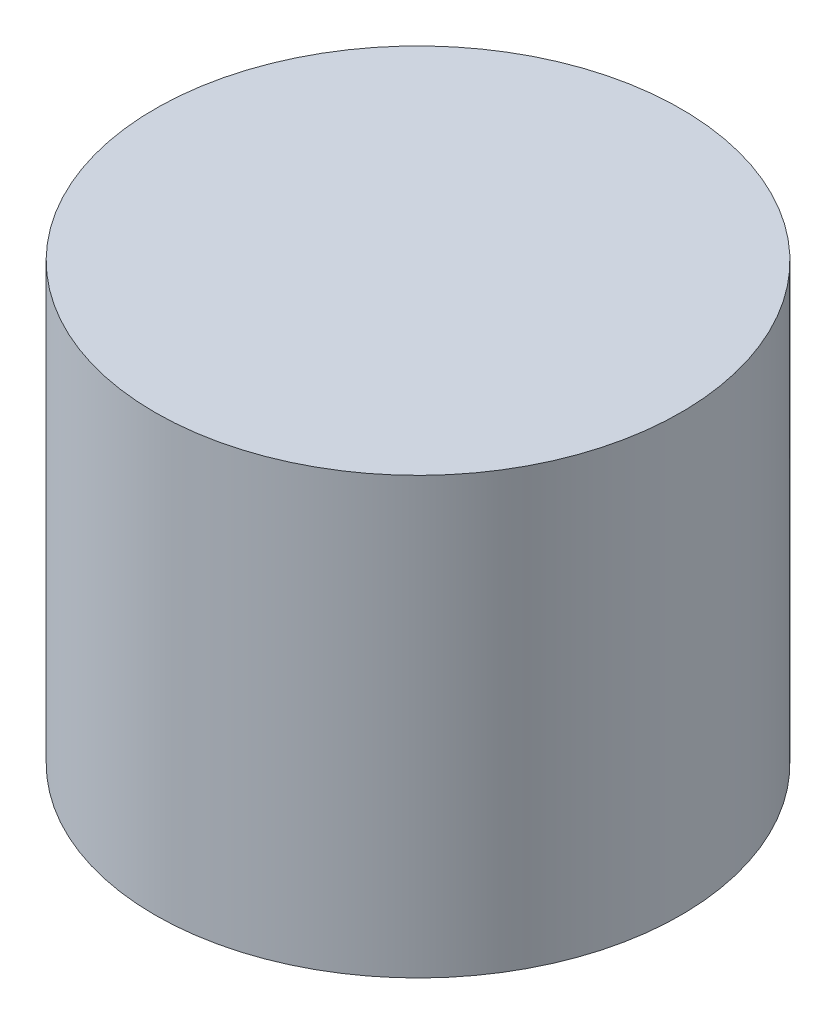
from build123d import *

# Parameters (mm, degrees)
SKETCH1_R           = 2.9
BOSS_EXTRUDE1_DEPTH = 4.8


with BuildPart() as part:
    # Sketch1 → Boss-Extrude1 (new body)
    with BuildSketch(Plane(origin=(0, 0, 0), x_dir=(1, 0, 0), z_dir=(0, 1, 0))):
        with Locations(Location((0, 0, 0), (0, 0, 270))):
            Circle(SKETCH1_R)
    extrude(amount=BOSS_EXTRUDE1_DEPTH)


solid = part.part
